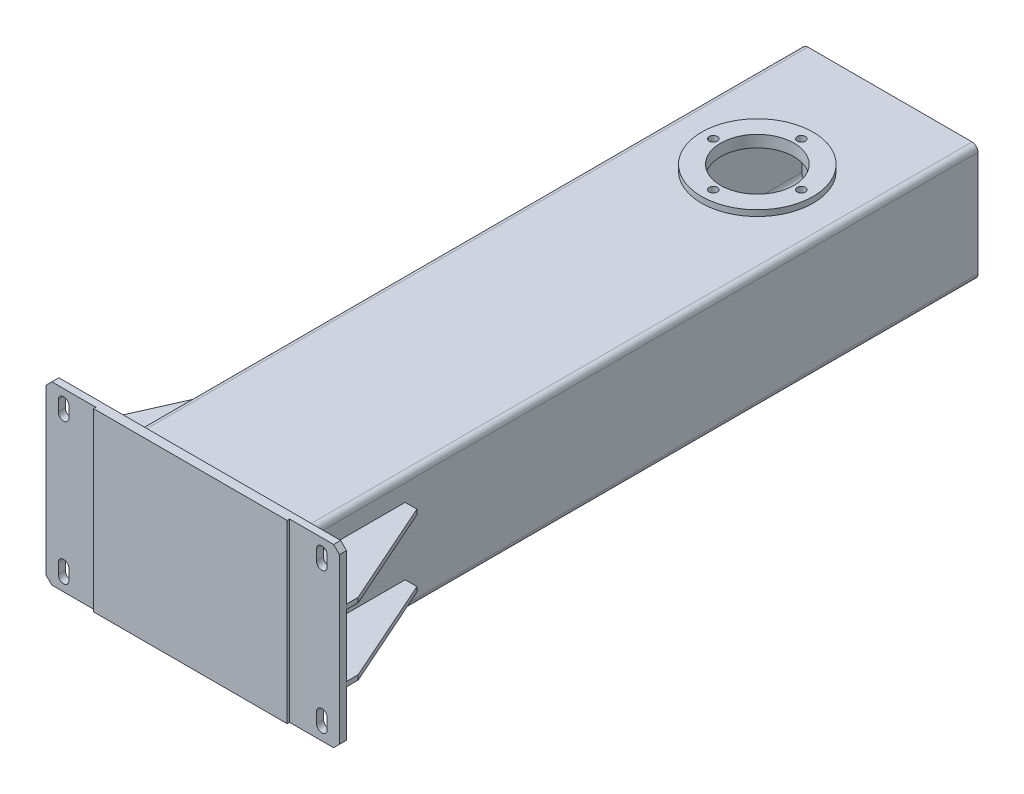
from build123d import *

# Parameters (mm, degrees)
EXTRUDE_1_DEPTH              = 1176
SKETCH_2_W                   = 500
SKETCH_2_H                   = 300
EXTRUDE_2_DEPTH              = 16
SKETCH_4_R                   = 95
CUT_EXTRUDE_2_DEPTH          = 1244.32779266
EXTRUDE_3_DEPTH              = 10
EXTRUDE_3_DEPTH_BACK         = 10
SKETCH_5_R                   = 95
SKETCH_5_R_2                 = 62.5
EXTRUDE_4_DEPTH              = 10
EXTRUDE_4_DEPTH_BACK         = 10
SKETCH_6_R                   = 95
SKETCH_6_R_2                 = 62.5
SKETCH_7_W                   = 7
SKETCH_7_H                   = 260
PATTERN_CIRCULAR_1_COUNT     = 4
PATTERN_CIRCULAR_2_COUNT     = 4
CHAMFER_1_SIZE               = 5
CHAMFER_2_SIZE               = 5
SKETCH_11_OUTSIDE_W          = 767.396
SKETCH_11_OUTSIDE_H          = 567.396
SKETCH_11_OUTSIDE_W_2        = 330
SKETCH_11_OUTSIDE_H_2        = 300
CUT_EXTRUDE_3_DEPTH          = 4
CHAMFER_3_SIZE               = 10
SKETCH_12_W                  = 100
SKETCH_12_H                  = 8
EXTRUDE_5_DEPTH              = 200
CUT_EXTRUDE_4_DEPTH          = 1235.754860001
EXTRUDE_6_DEPTH              = 10
HOLE_WIZARD_M16_3_AT_2_COUNT = 2
HOLE_WIZARD_M16_3_AT_2_PITCH = 277.848879789
SKETCH_19_W                  = 150
SKETCH_19_H                  = 100
CUT_EXTRUDE_5_DEPTH          = 20
SKETCH_20_R                  = 25
CUT_EXTRUDE_6_DEPTH          = 10
FILLET_1_R                   = 10
HOLE_WIZARD_M5_1_AT_2_COUNT  = 2
HOLE_WIZARD_M5_1_AT_2_PITCH  = 110
HOLE_WIZARD_M5_1_AT_3_COUNT  = 2
HOLE_WIZARD_M5_1_AT_3_PITCH  = 194.164878389
HOLE_WIZARD_M5_1_AT_4_COUNT  = 2
HOLE_WIZARD_M5_1_AT_4_PITCH  = 160
SKETCH_23_R                  = 9
CUT_EXTRUDE_7_DEPTH          = 1212.600594255
CUT_EXTRUDE_8_DEPTH          = 1212.600594255


with BuildPart() as part:
    # 草图1 → 凸台-拉伸1 (new body)
    with BuildSketch(Plane.XY):
        with BuildLine():
            Line((-140, 100), (140, 100))
            ThreePointArc((140, 100), (147.071067812, 97.071067812), (150, 90))
            Line((150, 90), (150, -90))
            ThreePointArc((150, -90), (147.071067812, -97.071067812), (140, -100))
            Line((140, -100), (-140, -100))
            ThreePointArc((-140, -100), (-147.071067812, -97.071067812), (-150, -90))
            Line((-150, -90), (-150, 90))
            ThreePointArc((-150, 90), (-147.071067812, 97.071067812), (-140, 100))
        make_face()
        with BuildLine():
            Line((-130, 90), (130, 90))
            ThreePointArc((130, 90), (137.071067812, 87.071067812), (140, 80))
            Line((140, 80), (140, -80))
            ThreePointArc((140, -80), (137.071067812, -87.071067812), (130, -90))
            Line((130, -90), (-130, -90))
            ThreePointArc((-130, -90), (-137.071067812, -87.071067812), (-140, -80))
            Line((-140, -80), (-140, 80))
            ThreePointArc((-140, 80), (-137.071067812, 87.071067812), (-130, 90))
        make_face(mode=Mode.SUBTRACT)
    extrude(amount=EXTRUDE_1_DEPTH)

    # 草图4 → 切除-拉伸2 (cut, through all)
    with BuildSketch(Plane.XZ.offset(100)):
        with Locations((0, 226)):
            Circle(SKETCH_4_R)
    extrude(amount=-CUT_EXTRUDE_2_DEPTH, mode=Mode.SUBTRACT)

    # 草图20 → 切除-拉伸6 (cut)
    with BuildSketch(Plane(origin=(150, 0, 0), x_dir=(0, 0, -1), z_dir=(1, 0, 0))):
        with Locations(Location((-1076, 0, 0), (0, 0, 90))):
            Circle(SKETCH_20_R)
    extrude(amount=-CUT_EXTRUDE_6_DEPTH, mode=Mode.SUBTRACT)


with BuildPart() as body_2:
    # 草图2 → 凸台-拉伸2 (new body)
    with BuildSketch(Plane.XY.offset(1176)):
        Rectangle(SKETCH_2_W, SKETCH_2_H)
    extrude(amount=EXTRUDE_2_DEPTH)

    # 草图11 outside → 切除-拉伸3 (cut)
    with BuildSketch(Plane.XY.offset(1192)):
        Rectangle(SKETCH_11_OUTSIDE_W, SKETCH_11_OUTSIDE_H)
        Rectangle(SKETCH_11_OUTSIDE_W_2, SKETCH_11_OUTSIDE_H_2, mode=Mode.SUBTRACT)
    extrude(amount=-CUT_EXTRUDE_3_DEPTH, mode=Mode.SUBTRACT)

    # 倒角3
    chamfer_3_edges = [body_2.edges().sort_by_distance(p)[0] for p in [
        (-250, 150, 1182),
        (250, 150, 1182),
        (250, -150, 1182),
        (-250, -150, 1182),
    ]]
    chamfer(chamfer_3_edges, length=CHAMFER_3_SIZE)

    # 草图23 → 切除-拉伸7 (cut, through all)
    with BuildSketch(Plane(origin=(0, 0, 1176), x_dir=(-1, 0, 0), z_dir=(0, 0, -1))):
        with Locations((-220, 120)):
            Circle(SKETCH_23_R)
        with Locations((-220, -120)):
            Circle(SKETCH_23_R)
        with Locations((220, -120)):
            Circle(SKETCH_23_R)
        with Locations((220, 120)):
            Circle(SKETCH_23_R)
    extrude(amount=-CUT_EXTRUDE_7_DEPTH, mode=Mode.SUBTRACT)

    # 草图24 → 切除-拉伸8 (cut, through all)
    with BuildSketch(Plane(origin=(0, 0, 1176), x_dir=(-1, 0, 0), z_dir=(0, 0, -1))):
        with BuildLine():
            Line((-211, 129), (-211, 111))
            ThreePointArc((-211, 111), (-220, 102), (-229, 111))
            Line((-229, 111), (-229, 129))
            ThreePointArc((-229, 129), (-220, 138), (-211, 129))
        make_face()
        with BuildLine():
            Line((-211, -111), (-211, -129))
            ThreePointArc((-211, -129), (-220, -138), (-229, -129))
            Line((-229, -129), (-229, -111))
            ThreePointArc((-229, -111), (-220, -102), (-211, -111))
        make_face()
        with BuildLine():
            Line((211, 129), (211, 111))
            ThreePointArc((211, 111), (220, 102), (229, 111))
            Line((229, 111), (229, 129))
            ThreePointArc((229, 129), (220, 138), (211, 129))
        make_face()
        with BuildLine():
            Line((211, -111), (211, -129))
            ThreePointArc((211, -129), (220, -138), (229, -129))
            Line((229, -129), (229, -111))
            ThreePointArc((229, -111), (220, -102), (211, -111))
        make_face()
    extrude(amount=-CUT_EXTRUDE_8_DEPTH, mode=Mode.SUBTRACT)


with BuildPart() as body_3:
    # 草图5 → 凸台-拉伸3 (new, two sides: drawn at the far end of the back side and taken through both)
    with BuildSketch(Plane.XZ.offset(100).offset(-EXTRUDE_3_DEPTH_BACK)):
        with Locations((0, 226)):
            Circle(SKETCH_5_R)
        with Locations((0, 226)):
            Circle(SKETCH_5_R_2, mode=Mode.SUBTRACT)
    extrude(amount=EXTRUDE_3_DEPTH + EXTRUDE_3_DEPTH_BACK)

    # 草图9 → M16 螺纹孔2 (revolve, cut)
    with BuildSketch(Plane(origin=(0, -110, 151), x_dir=(0, 0, -1), z_dir=(1, 0, 0))):
        Polygon((0, 0), (0, 42.206024333), (7, 38), (7, 0), align=None)
    hole_wizard_m16_2 = revolve(axis=Axis((0, -116.35, 151), (0, 1, 0)), mode=Mode.SUBTRACT)

    # 阵列(圆周)2: M16 螺纹孔2 ×4 about axis
    pattern_circular_2_axis = Axis((0, 0, 226), (0, 1, 0))
    for i in range(1, PATTERN_CIRCULAR_2_COUNT):
        add(hole_wizard_m16_2.rotate(pattern_circular_2_axis, i * 360 / PATTERN_CIRCULAR_2_COUNT), mode=Mode.SUBTRACT)

    # 倒角1
    chamfer_1_edges = [body_3.edges().sort_by_distance(p)[0] for p in [
        (-95, -90, 226),
    ]]
    chamfer(chamfer_1_edges, length=CHAMFER_1_SIZE)


with BuildPart() as body_4:
    # 草图6 → 凸台-拉伸4 (new, two sides: drawn at the far end of the back side and taken through both)
    with BuildSketch(Plane(origin=(0, 100, 0), x_dir=(1, 0, 0), z_dir=(0, 1, 0)).offset(-EXTRUDE_4_DEPTH_BACK)):
        with Locations(Location((0, -226, 0), (0, 0, 270))):
            Circle(SKETCH_6_R)
        with Locations(Location((0, -226, 0), (0, 0, 270))):
            Circle(SKETCH_6_R_2, mode=Mode.SUBTRACT)
    extrude(amount=EXTRUDE_4_DEPTH + EXTRUDE_4_DEPTH_BACK)

    # 草图7 → M16 螺纹孔1 (revolve, cut)
    with BuildSketch(Plane(origin=(0, 110, 151), x_dir=(0, 0, 1), z_dir=(1, 0, 0))):
        with Locations((3.5, 130)):
            Rectangle(SKETCH_7_W, SKETCH_7_H)
    hole_wizard_m16_1 = revolve(axis=Axis((0, 116.35, 151), (0, -1, 0)), mode=Mode.SUBTRACT)

    # 阵列(圆周)1: M16 螺纹孔1 ×4 about axis
    pattern_circular_1_axis = Axis((0, 0, 226), (0, 1, 0))
    for i in range(1, PATTERN_CIRCULAR_1_COUNT):
        add(hole_wizard_m16_1.rotate(pattern_circular_1_axis, i * 360 / PATTERN_CIRCULAR_1_COUNT), mode=Mode.SUBTRACT)

    # 倒角2
    chamfer_2_edges = [body_4.edges().sort_by_distance(p)[0] for p in [
        (0, 90, 131),
    ]]
    chamfer(chamfer_2_edges, length=CHAMFER_2_SIZE)


with BuildPart() as body_5:
    # 草图12 → 凸台-拉伸5 (new body)
    with BuildSketch(Plane(origin=(0, 0, 1176), x_dir=(-1, 0, 0), z_dir=(0, 0, -1))):
        with Locations((-200, 57.114658006)):
            Rectangle(SKETCH_12_W, SKETCH_12_H)
    extrude(amount=EXTRUDE_5_DEPTH)

    # 草图13 → 切除-拉伸4 (cut, through all)
    with BuildSketch(Plane.XZ.offset(-53.114658006)):
        Polygon((150, 1176), (155, 1176), (150, 1171), align=None)
        Polygon((250, 1156), (250, 976), (170, 976), align=None)
    extrude(amount=-CUT_EXTRUDE_4_DEPTH, mode=Mode.SUBTRACT)


with BuildPart() as body_6:
    # 镜向1: mirrored copy
    add(body_5.part.mirror(Plane.ZX))


with BuildPart() as body_7:
    # 镜向2: mirrored copy
    add(body_6.part.mirror(Plane(origin=(0, 0, 0), x_dir=(0, 0, 1), z_dir=(1, 0, 0))))


with BuildPart() as body_8:
    # Mirror 2 2: mirrored copy
    add(body_5.part.mirror(Plane(origin=(0, 0, 0), x_dir=(0, 0, 1), z_dir=(1, 0, 0))))


with BuildPart() as body_9:
    # 草图16 → 凸台-拉伸6 (new body)
    with BuildSketch(Plane(origin=(0, 0, 0), x_dir=(-1, 0, 0), z_dir=(0, 0, -1))):
        with BuildLine():
            Line((130, -90), (-130, -90))
            ThreePointArc((-130, -90), (-137.071067812, -87.071067812), (-140, -80))
            Line((-140, -80), (-140, 80))
            ThreePointArc((-140, 80), (-137.071067812, 87.071067812), (-130, 90))
            Line((-130, 90), (130, 90))
            ThreePointArc((130, 90), (137.071067812, 87.071067812), (140, 80))
            Line((140, 80), (140, -80))
            ThreePointArc((140, -80), (137.071067812, -87.071067812), (130, -90))
        make_face()
    extrude(amount=-EXTRUDE_6_DEPTH)

    # 草图17 → M16 螺纹孔3 (revolve, cut)
    with BuildSketch(Plane(origin=(-120, -70, 0), x_dir=(0, 1, 0), z_dir=(1, 0, 0))):
        Polygon((0, 0), (0, 42.206024333), (7, 38), (7, 0), align=None)
    hole_wizard_m16_3 = revolve(axis=Axis((-120, -70, -6.35), (0, 0, 1)), mode=Mode.SUBTRACT)

    # M16 螺纹孔3 at 2: M16 螺纹孔3 ×2
    with Locations(*[Vector(0.8637789008984335, 0.5038710255240861, 0) * (i * HOLE_WIZARD_M16_3_AT_2_PITCH) for i in range(1, HOLE_WIZARD_M16_3_AT_2_COUNT)]):
        add(hole_wizard_m16_3, mode=Mode.SUBTRACT)

    # 草图19 → 切除-拉伸5 (cut)
    with BuildSketch(Plane(origin=(0, 0, 0), x_dir=(-1, 0, 0), z_dir=(0, 0, -1))):
        Rectangle(SKETCH_19_W, SKETCH_19_H)
    extrude(amount=-CUT_EXTRUDE_5_DEPTH, mode=Mode.SUBTRACT)

    # 圆角1
    fillet_1_edges = [body_9.edges().sort_by_distance(p)[0] for p in [
        (-75, 50, 5),
        (-75, -50, 5),
        (75, -50, 5),
        (75, 50, 5),
    ]]
    fillet(fillet_1_edges, radius=FILLET_1_R)

    # 草图21 → M5 螺纹孔1 (revolve, cut)
    with BuildSketch(Plane(origin=(-80, 55, 0), x_dir=(0, 1, 0), z_dir=(1, 0, 0))):
        Polygon((0, 0), (0, 15.2618073), (2.1, 14), (2.1, 0), align=None)
    hole_wizard_m5_1 = revolve(axis=Axis((-80, 55, -6.35), (0, 0, 1)), mode=Mode.SUBTRACT)

    # M5 螺纹孔1 at 2: M5 螺纹孔1 ×2
    with Locations(*[(0, -i * HOLE_WIZARD_M5_1_AT_2_PITCH, 0) for i in range(1, HOLE_WIZARD_M5_1_AT_2_COUNT)]):
        add(hole_wizard_m5_1, mode=Mode.SUBTRACT)

    # M5 螺纹孔1 at 3: M5 螺纹孔1 ×2
    with Locations(*[Vector(0.8240419241993676, -0.5665288228870652, 0) * (i * HOLE_WIZARD_M5_1_AT_3_PITCH) for i in range(1, HOLE_WIZARD_M5_1_AT_3_COUNT)]):
        add(hole_wizard_m5_1, mode=Mode.SUBTRACT)

    # M5 螺纹孔1 at 4: M5 螺纹孔1 ×2
    with Locations(*[(i * HOLE_WIZARD_M5_1_AT_4_PITCH, 0, 0) for i in range(1, HOLE_WIZARD_M5_1_AT_4_COUNT)]):
        add(hole_wizard_m5_1, mode=Mode.SUBTRACT)


solid = Compound([part.part, body_2.part, body_3.part, body_4.part, body_5.part, body_6.part, body_7.part, body_8.part, body_9.part])
